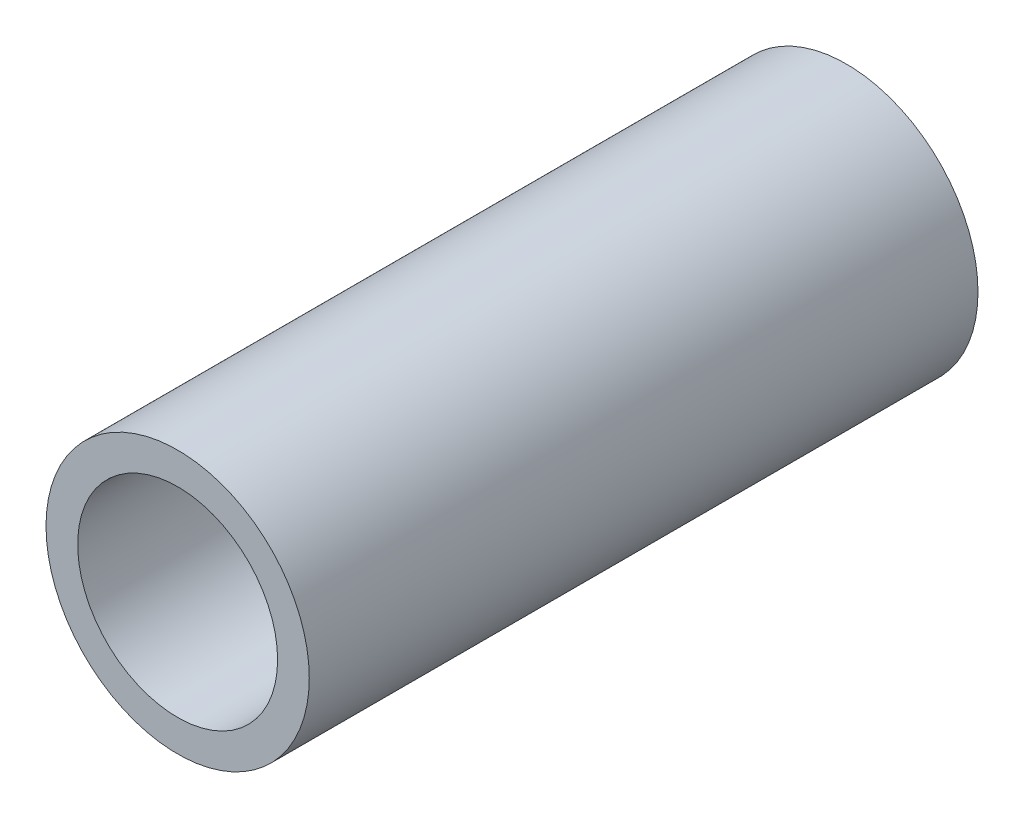
from build123d import *

# Parameters (mm, degrees)
SKETCH1_R             = 2.5
BOSS_EXTRUDE1_DEPTH   = 12.7
F_6_CLEARANCE_HOLE1_D = 3.7973


with BuildPart() as part:
    # Sketch1 → Boss-Extrude1 (new body)
    with BuildSketch(Plane.XY):
        Circle(SKETCH1_R)
    extrude(amount=BOSS_EXTRUDE1_DEPTH)

    # #6 Clearance Hole1 (through all)
    with Locations(Plane.XY.offset(12.7)):
        with Locations((0, 0)):
            Hole(F_6_CLEARANCE_HOLE1_D / 2)


solid = part.part
